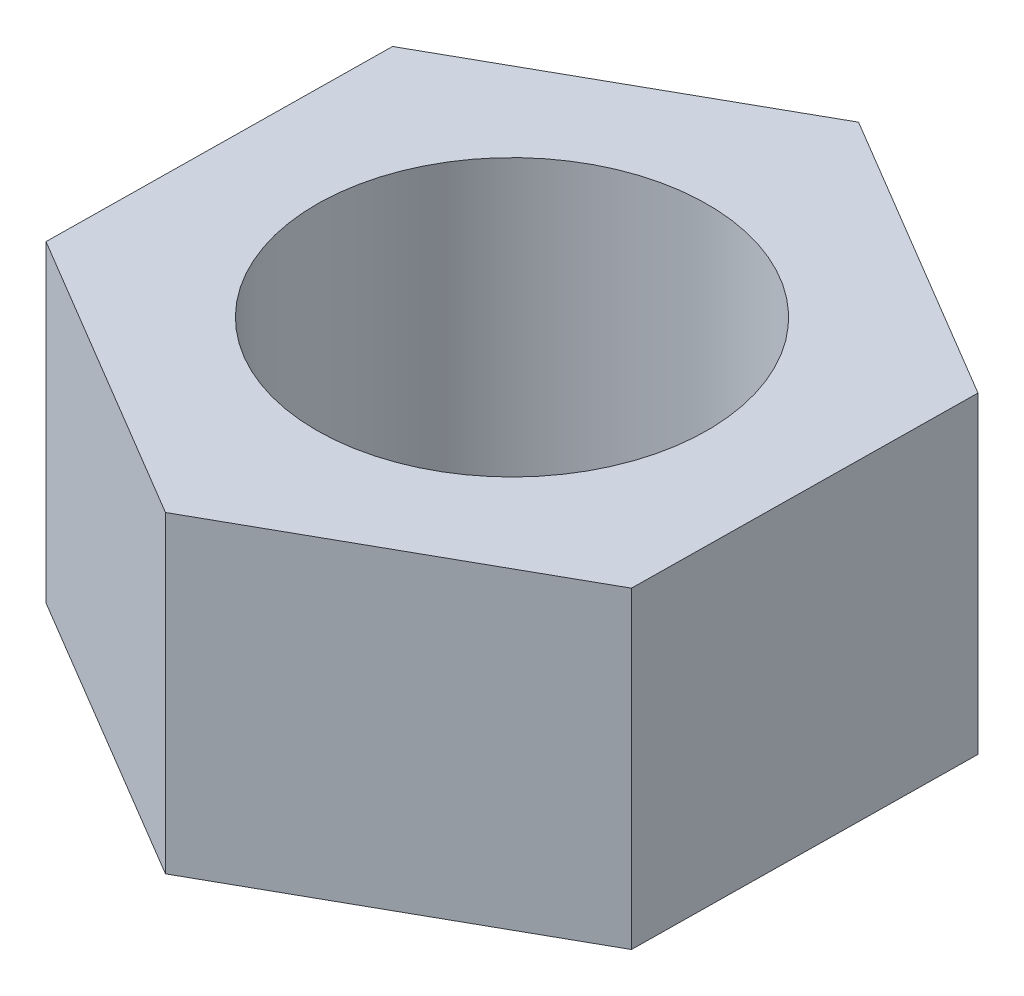
from build123d import *

# Parameters (mm, degrees)
SKETCH2_R           = 2
BOSS_EXTRUDE1_DEPTH = 3.2


with BuildPart() as part:
    # Sketch2 → Boss-Extrude1 (new body)
    with BuildSketch(Plane(origin=(0, 0, 0), x_dir=(1, 0, 0), z_dir=(0, 1, 0))):
        Polygon((3.00903454, -1.787655206), (3.052672092, 1.712072749), (0.043637552, 3.499727956), (-3.00903454, 1.787655206), (-3.052672092, -1.712072749), (-0.043637552, -3.499727956), align=None)
        with Locations(Location((0, 0, 0), (0, 0, 270))):
            Circle(SKETCH2_R, mode=Mode.SUBTRACT)
    extrude(amount=BOSS_EXTRUDE1_DEPTH)


solid = part.part
